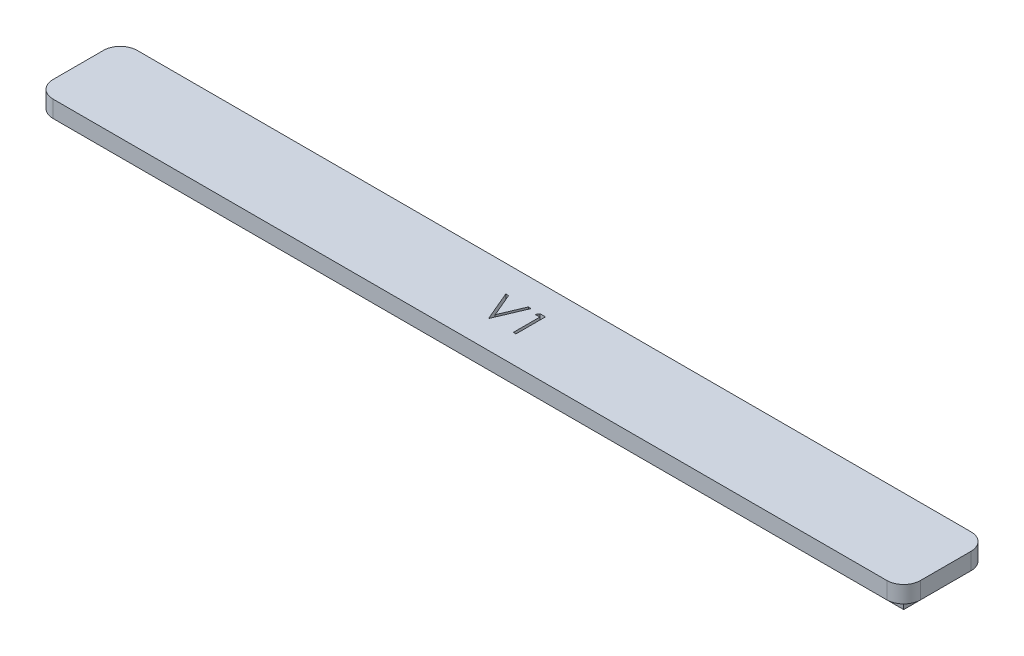
from build123d import *

# Parameters (mm, degrees)
SKETCH1_W           = 99
SKETCH1_H           = 6
BOSS_EXTRUDE1_DEPTH = 2
SKETCH2_W           = 101
SKETCH2_H           = 8
BOSS_EXTRUDE3_DEPTH = 2
DRAFT1_ANGLE        = 10
SKETCH3_W           = 103
SKETCH3_H           = 10
BOSS_EXTRUDE4_DEPTH = 2
FILLET1_R           = 2
CUT_EXTRUDE1_DEPTH  = 1


with BuildPart() as part:
    # Sketch1 → Boss-Extrude1 (new body)
    with BuildSketch(Plane(origin=(0, 0, 0), x_dir=(1, 0, 0), z_dir=(0, 1, 0))):
        Rectangle(SKETCH1_W, SKETCH1_H)
    extrude(amount=BOSS_EXTRUDE1_DEPTH)

    # Draft1
    draft1_faces = [part.faces().sort_by_distance(p)[0] for p in [
        (49.5, 1, 0),
        (0, 1, 3),
        (-49.5, 1, 0),
        (0, 1, -3),
    ]]
    draft(draft1_faces, Plane(origin=(0, 0, 0), x_dir=(0, 0, -1), z_dir=(0, -1, 0)), DRAFT1_ANGLE)



with BuildPart() as body_2:
    # Sketch2 → Boss-Extrude3 (new body)
    with BuildSketch(Plane(origin=(0, 2, 0), x_dir=(1, 0, 0), z_dir=(0, 1, 0))):
        Rectangle(SKETCH2_W, SKETCH2_H)
    extrude(amount=BOSS_EXTRUDE3_DEPTH)


with BuildPart() as part_1:
    add(part.part)

    add(body_2.part)  # Boss-Extrude4 merges body 2
    # Sketch3 → Boss-Extrude4 (add)
    with BuildSketch(Plane(origin=(0, 4, 0), x_dir=(1, 0, 0), z_dir=(0, 1, 0))):
        Rectangle(SKETCH3_W, SKETCH3_H)
    extrude(amount=-BOSS_EXTRUDE4_DEPTH)

    # Fillet1
    fillet1_edges = [part_1.edges().sort_by_distance(p)[0] for p in [
        (-51.5, 3, 5),
        (-51.5, 3, -5),
        (51.5, 3, -5),
        (51.5, 3, 5),
    ]]
    fillet(fillet1_edges, radius=FILLET1_R)

    # Sketch4 → Cut-Extrude1 (cut)
    with BuildSketch(Plane(origin=(0, 4, 0), x_dir=(1, 0, 0), z_dir=(0, 1, 0))):
        Polygon((-2.575148278, 1.834748189), (-2.238609816, 1.834748189), (-1.07194315, -0.923464952), (0.094723517, 1.834748189), (0.431261979, 1.834748189), (-1.049507252, -1.665251811), (-1.094379047, -1.665251811), align=None)
        Polygon((1.489254767, 1.834748189), (2.136390184, 1.834748189), (2.136390184, -1.665251811), (1.82228762, -1.665251811), (1.82228762, 1.47577383), (1.283826081, 1.47577383), align=None)
    extrude(amount=-CUT_EXTRUDE1_DEPTH, mode=Mode.SUBTRACT)


solid = part_1.part
